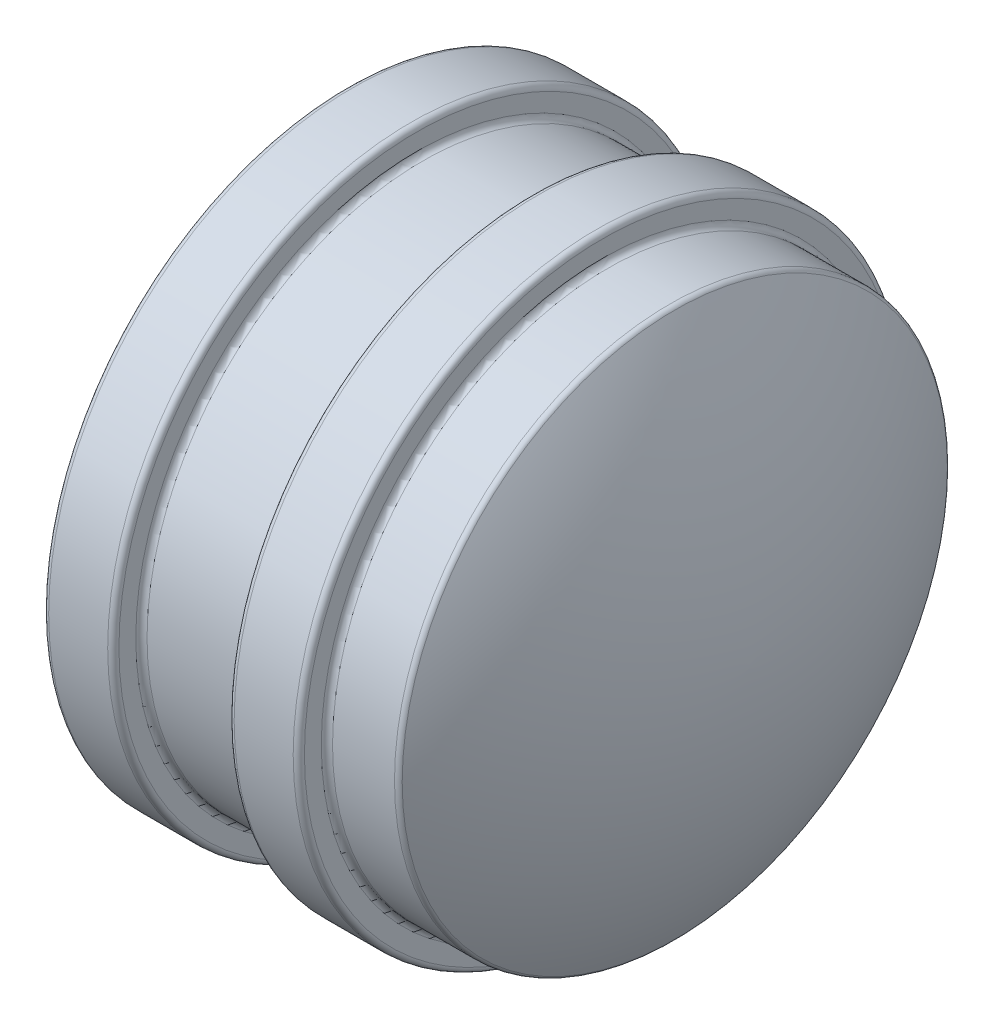
from build123d import *

# Parameters (mm, degrees)
FILLET1_R          = 0.254
SKETCH3_R          = 2.54
SKETCH3_R_2        = 2.286
CUT_EXTRUDE1_DEPTH = 6.35
FILLET2_R          = 1.27
FILLET3_R          = 0.254


with BuildPart() as part:
    # Sketch2 → Revolve1 (revolve)
    with BuildSketch(Plane.XY, mode=Mode.PRIVATE) as revolve1_sk:
        with BuildLine():
            Line((0, 0), (18.1864, 0))
            ThreePointArc((18.1864, 0), (17.275816652, 6.444487241), (14.7574, 12.446))
            Line((14.7574, 12.446), (11.557, 12.446))
            Line((11.557, 12.446), (11.557, 13.716))
            Line((11.557, 13.716), (8.382, 13.716))
            Line((8.382, 13.716), (8.382, 12.446))
            Line((8.382, 12.446), (3.175, 12.446))
            Line((3.175, 12.446), (3.175, 13.716))
            Line((3.175, 13.716), (0, 13.716))
            Line((0, 13.716), (0, 0))
        make_face()
    revolve(revolve1_sk.sketch.rotate(Axis((0, 0, 0), (1, 0, 0)), 90), axis=Axis((0, 0, 0), (1, 0, 0)))

    # Fillet1
    fillet1_edges = [part.edges().sort_by_distance(p)[0] for p in [
        (3.175, 0, -12.446),
        (3.175, 0, -13.716),
        (0, 0, -13.716),
        (14.7574, 0, -12.446),
        (11.557, 0, -12.446),
        (11.557, 0, -13.716),
        (8.382, 0, -13.716),
        (8.382, 0, -12.446),
    ]]
    fillet(fillet1_edges, radius=FILLET1_R)

    # Sketch3 → Cut-Extrude1 (cut)
    with BuildSketch(Plane.ZY):
        Circle(SKETCH3_R)
        with Locations((0, 7.112)):
            Circle(SKETCH3_R_2)
        with Locations((5.028943428, 5.028943428)):
            Circle(SKETCH3_R_2)
        with Locations((7.112, 0)):
            Circle(SKETCH3_R_2)
        with Locations((5.028943428, -5.028943428)):
            Circle(SKETCH3_R_2)
        with Locations((0, -7.112)):
            Circle(SKETCH3_R_2)
        with Locations((-5.028943428, -5.028943428)):
            Circle(SKETCH3_R_2)
        with Locations((-7.112, 0)):
            Circle(SKETCH3_R_2)
        with Locations((-5.028943428, 5.028943428)):
            Circle(SKETCH3_R_2)
    extrude(amount=-CUT_EXTRUDE1_DEPTH, mode=Mode.SUBTRACT)

    # Fillet2
    fillet2_edges = [part.edges().sort_by_distance(p)[0] for p in [
        (6.35, 0, -2.54),
        (6.35, 7.112, -2.286),
        (6.35, 5.028943428, 2.742943428),
        (6.35, 0, 4.826),
        (6.35, -5.028943428, 2.742943428),
        (6.35, -7.112, -2.286),
        (6.35, -5.028943428, -7.314943428),
        (6.35, 0, -9.398),
        (6.35, 5.028943428, -7.314943428),
    ]]
    fillet(fillet2_edges, radius=FILLET2_R)

    # Fillet3
    fillet3_edges = [part.edges().sort_by_distance(p)[0] for p in [
        (0, 0, -2.54),
        (0, 7.112, -2.286),
        (0, 5.028943428, 2.742943428),
        (0, 0, 4.826),
        (0, -5.028943428, 2.742943428),
        (0, -7.112, -2.286),
        (0, -5.028943428, -7.314943428),
        (0, 0, -9.398),
        (0, 5.028943428, -7.314943428),
    ]]
    fillet(fillet3_edges, radius=FILLET3_R)


solid = part.part
